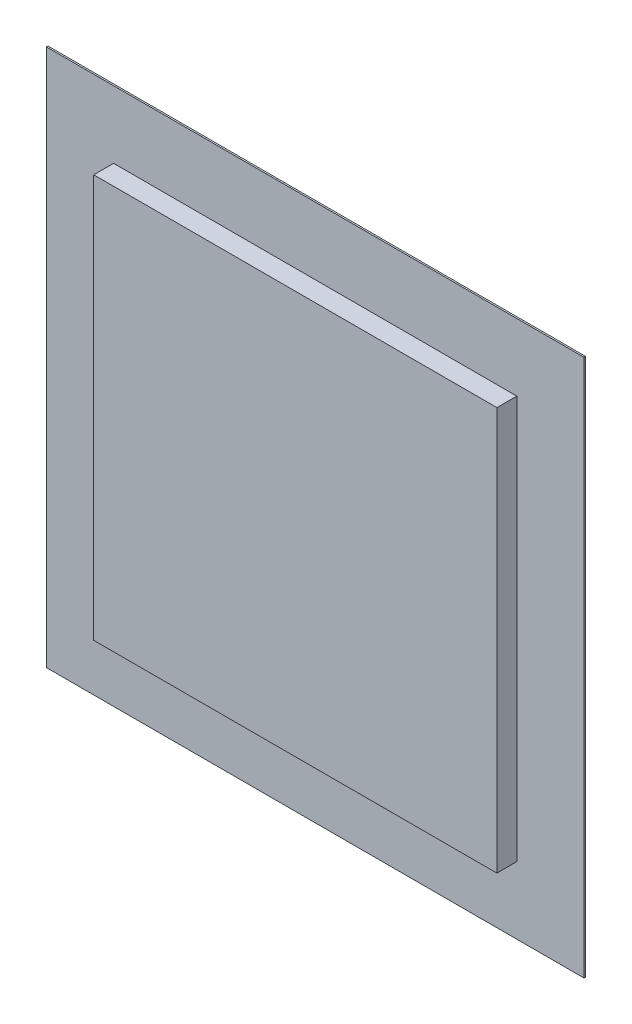
from build123d import *

# Parameters (mm, degrees)
SKETCH1_W           = 100
SKETCH1_H           = 100
BOSS_EXTRUDE1_DEPTH = 0.3
SKETCH2_W           = 75
SKETCH2_H           = 75
BOSS_EXTRUDE2_DEPTH = 4


with BuildPart() as part:
    # Sketch1 → Boss-Extrude1 (new body)
    with BuildSketch(Plane.XY):
        Rectangle(SKETCH1_W, SKETCH1_H)
    extrude(amount=BOSS_EXTRUDE1_DEPTH)

    # Sketch2 → Boss-Extrude2 (add)
    with BuildSketch(Plane.XY):
        Rectangle(SKETCH2_W, SKETCH2_H)
    extrude(amount=BOSS_EXTRUDE2_DEPTH)


solid = part.part
